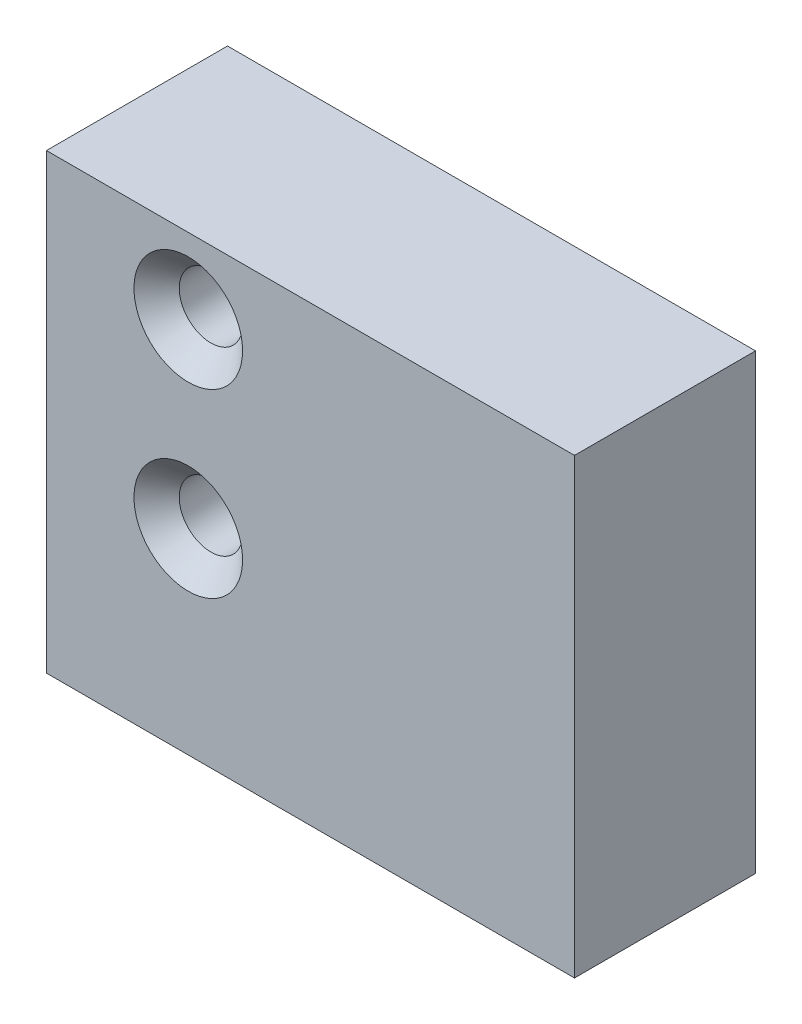
from build123d import *

# Parameters (mm, degrees)
ESBO_O2_W                                    = 35
ESBO_O2_H                                    = 30
RESSALTO_EXTRUS_O1_DEPTH                     = 12
BROCA_DE_ROSQUEAR_PARA_TARRAXA_DE_M5X0_8_D   = 4.2
BROCA_DE_ROSQUEAR_PARA_TARRAXA_DE_M5_2_D     = 4.2
BROCA_DE_ROSQUEAR_PARA_TARRAXA_DE_M5_2_DEPTH = 20
BROCA_DE_ROSQUEAR_PARA_TARRAXA_DE_M5_2_TIP   = 1.2618073
CHANFRO1_SIZE                                = 1.5
CHANFRO2_SIZE                                = 1.5
CHANFRO3_SIZE                                = 1.5


with BuildPart() as part:
    # Esboço2 → Ressalto-extrusão1 (new body)
    with BuildSketch(Plane.XY):
        with Locations((119.430382681, 3.163019551)):
            Rectangle(ESBO_O2_W, ESBO_O2_H)
    extrude(amount=RESSALTO_EXTRUS_O1_DEPTH)

    # Broca de rosquear para tarraxa de M5x0.8 (through all)
    with Locations(Plane.XY.offset(12)):
        with Locations((111.330382681, 13.163019551), (111.330382681, 1.163019551)):
            Hole(BROCA_DE_ROSQUEAR_PARA_TARRAXA_DE_M5X0_8_D / 2)

    # Broca de rosquear para tarraxa de M5 2
    with Locations(Plane.XZ.offset(11.836980449)):
        with Locations((130.930382681, 6)):
            Hole(BROCA_DE_ROSQUEAR_PARA_TARRAXA_DE_M5_2_D / 2, depth=BROCA_DE_ROSQUEAR_PARA_TARRAXA_DE_M5_2_DEPTH)
            with Locations((0, 0, -(BROCA_DE_ROSQUEAR_PARA_TARRAXA_DE_M5_2_DEPTH + BROCA_DE_ROSQUEAR_PARA_TARRAXA_DE_M5_2_TIP / 2))):  # 118° drill point
                Cone(0, BROCA_DE_ROSQUEAR_PARA_TARRAXA_DE_M5_2_D / 2, BROCA_DE_ROSQUEAR_PARA_TARRAXA_DE_M5_2_TIP, mode=Mode.SUBTRACT)

    # Chanfro1
    chanfro1_edges = [part.edges().sort_by_distance(p)[0] for p in [
        (113.430382681, 1.163019551, 12),
        (113.430382681, 13.163019551, 12),
    ]]
    chamfer(chanfro1_edges, length=CHANFRO1_SIZE)

    # Chanfro2
    chanfro2_edges = [part.edges().sort_by_distance(p)[0] for p in [
        (113.430382681, 1.163019551, 0),
    ]]
    chamfer(chanfro2_edges, length=CHANFRO2_SIZE)

    # Chanfro3
    chanfro3_edges = [part.edges().sort_by_distance(p)[0] for p in [
        (113.430382681, 13.163019551, 0),
    ]]
    chamfer(chanfro3_edges, length=CHANFRO3_SIZE)


solid = part.part
